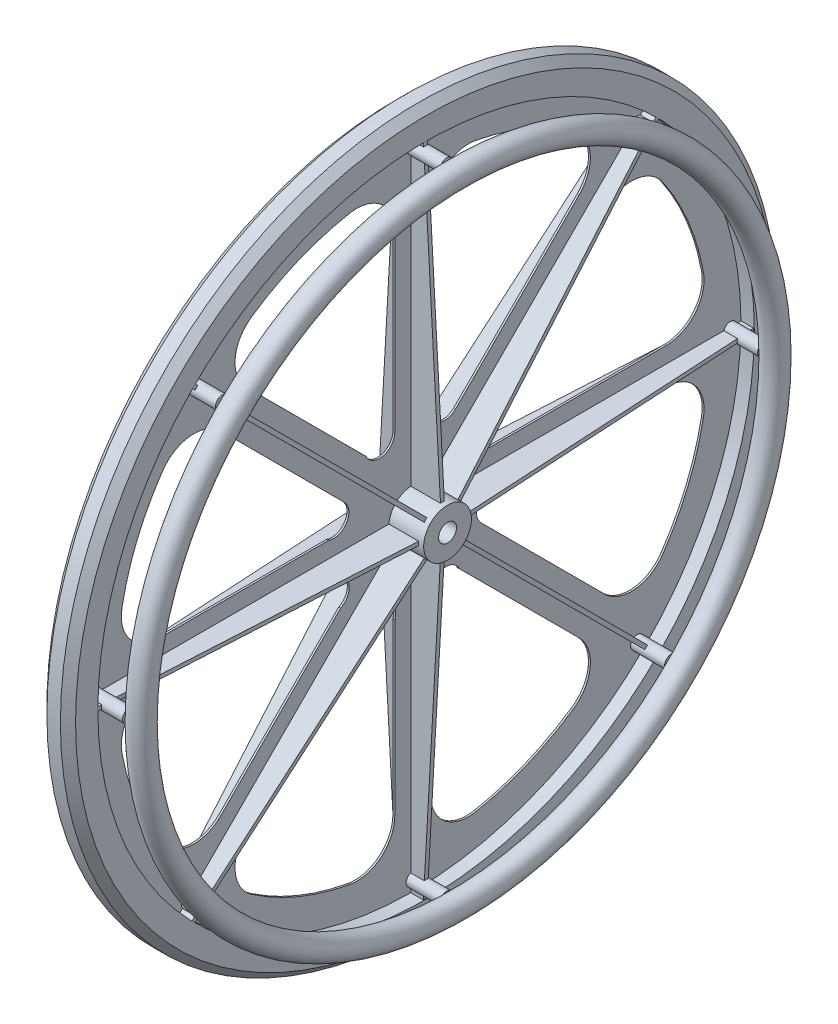
from build123d import *

# Parameters (mm, degrees)
RESSALTO_EXTRUS_O1_DEPTH      = 30
RESSALTO_EXTRUS_O1_DEPTH_BACK = 30
ESBO_O1_R                     = 20
RESSALTO_EXTRUS_O3_DEPTH      = 0.8
RESSALTO_EXTRUS_O3_DEPTH_BACK = 0.8
ESBO_O4_R                     = 300
RESSALTO_EXTRUS_O5_DEPTH      = 12
RESSALTO_EXTRUS_O5_DEPTH_BACK = 12
ESBO_O10_R                    = 300
ESBO_O10_R_2                  = 275
CORTE_EXTRUS_O1_DEPTH         = 426.380582538
ESBO_O17_R                    = 5.55
RESSALTO_EXTRUS_O6_DEPTH      = 28.5
PADR_OCIRCULAR2_COUNT         = 8
ESBO_O19_R                    = 7.5
CORTE_EXTRUS_O2_DEPTH         = 429.485705727
ESBO_O20_R                    = 9.525
CHANFRO1_SIZE                 = 6.35


with BuildPart() as part:
    # Esboço1 → Ressalto-extrusão1 (new, two sides: drawn at the far end of the back side and taken through both)
    with BuildSketch(Plane(origin=(0, 0, 0), x_dir=(0, 0, -1), z_dir=(1, 0, 0)).offset(-RESSALTO_EXTRUS_O1_DEPTH_BACK)):
        Circle(ESBO_O1_R)
    extrude(amount=RESSALTO_EXTRUS_O1_DEPTH + RESSALTO_EXTRUS_O1_DEPTH_BACK)

    # Esboço4 → Ressalto-extrusão3 (add, two sides: drawn at the far end of the back side and taken through both)
    with BuildSketch(Plane(origin=(0, 0, 0), x_dir=(0, 0, -1), z_dir=(1, 0, 0)).offset(-RESSALTO_EXTRUS_O3_DEPTH_BACK)):
        Circle(ESBO_O4_R)
    extrude(amount=RESSALTO_EXTRUS_O3_DEPTH + RESSALTO_EXTRUS_O3_DEPTH_BACK)

    # Esboço10 → Ressalto-extrusão5 (add, two sides: drawn at the far end of the back side and taken through both)
    with BuildSketch(Plane(origin=(0, 0, 0), x_dir=(0, 0, -1), z_dir=(1, 0, 0)).offset(-RESSALTO_EXTRUS_O5_DEPTH_BACK)):
        Circle(ESBO_O10_R)
        Circle(ESBO_O10_R_2, mode=Mode.SUBTRACT)
    extrude(amount=RESSALTO_EXTRUS_O5_DEPTH + RESSALTO_EXTRUS_O5_DEPTH_BACK)

    # Esboço13 → Corte-extrusão1 (cut, through all)
    with BuildSketch(Plane.ZY.offset(0.8)):
        with BuildLine():
            Line((15, 212.365110129), (15, 65.865172562))
            ThreePointArc((15, 65.865172562), (24.874671768, 53.48343115), (39.142916596, 60.356120031))
            Line((39.142916596, 60.356120031), (139.558207742, 160.771411177))
            ThreePointArc((139.558207742, 160.771411177), (148.67140977, 186.655177943), (134.206510949, 209.974408962))
            ThreePointArc((134.206510949, 209.974408962), (95.624843033, 230.85879295), (53.575994481, 243.372662424))
            ThreePointArc((53.575994481, 243.372662424), (26.858580051, 237.111704084), (15, 212.365110129))
        make_face()
    corte_extrus_o1 = extrude(amount=-CORTE_EXTRUS_O1_DEPTH, mode=Mode.SUBTRACT)

    # Esboço14 → Loft1 section 0
    with BuildSketch(Plane(origin=(0, 0, 0), x_dir=(1, 0, 0), z_dir=(0, 1, 0))):
        with BuildLine():
            Line((-26.8, -1.6), (26.8, -1.6))
            Line((26.8, -1.6), (26.8, 1.6))
            Line((26.8, 1.6), (-26.8, 1.6))
            Line((-26.8, 1.6), (-26.8, -1.6))
        make_face()
    # Esboço16 → Loft1 section 1
    with BuildSketch(Plane(origin=(0, 280, 0), x_dir=(1, 0, 0), z_dir=(0, 1, 0))):
        with BuildLine():
            Line((-11.115, -1.6), (11.115, -1.6))
            Line((11.115, -1.6), (11.115, 1.6))
            Line((11.115, 1.6), (-11.115, 1.6))
            Line((-11.115, 1.6), (-11.115, -1.6))
        make_face()
    loft1 = loft()

    # Esboço17 → Ressalto-extrusão6 (add)
    with BuildSketch(Plane(origin=(0.8, 0, 0), x_dir=(0, 0, -1), z_dir=(1, 0, 0))):
        with Locations((0, 266)):
            Circle(ESBO_O17_R)
    ressalto_extrus_o6 = extrude(amount=RESSALTO_EXTRUS_O6_DEPTH)

    # PadrãoCircular2: Corte-extrusão1, Loft1, Ressalto-extrusão6 ×8 about axis
    padr_ocircular2_axis = Axis((12, 0, 0), (1, 0, 0))
    add([corte_extrus_o1.rotate(padr_ocircular2_axis, i * 360 / PADR_OCIRCULAR2_COUNT) for i in range(1, PADR_OCIRCULAR2_COUNT)], mode=Mode.SUBTRACT)
    add([loft1.rotate(padr_ocircular2_axis, i * 360 / PADR_OCIRCULAR2_COUNT) for i in range(1, PADR_OCIRCULAR2_COUNT)])
    add([ressalto_extrus_o6.rotate(padr_ocircular2_axis, i * 360 / PADR_OCIRCULAR2_COUNT) for i in range(1, PADR_OCIRCULAR2_COUNT)])

    # Esboço19 → Corte-extrusão2 (cut, through all)
    with BuildSketch(Plane(origin=(30, 0, 0), x_dir=(0, 0, -1), z_dir=(1, 0, 0))):
        Circle(ESBO_O19_R)
    extrude(amount=-CORTE_EXTRUS_O2_DEPTH, mode=Mode.SUBTRACT)

    # Chanfro1
    chanfro1_edges = [part.edges().sort_by_distance(p)[0] for p in [
        (-12, 0, 300),
        (12, 0, 300),
    ]]
    chamfer(chanfro1_edges, length=CHANFRO1_SIZE)


with BuildPart() as body_2:
    # Esboço20 → Revolução1 (revolve)
    with BuildSketch(Plane.XY):
        with Locations((38.825, 265.52302415)):
            Circle(ESBO_O20_R)
    revolve(axis=Axis((-33.9175, 0, 0), (1, 0, 0)))


solid = Compound([part.part, body_2.part])
